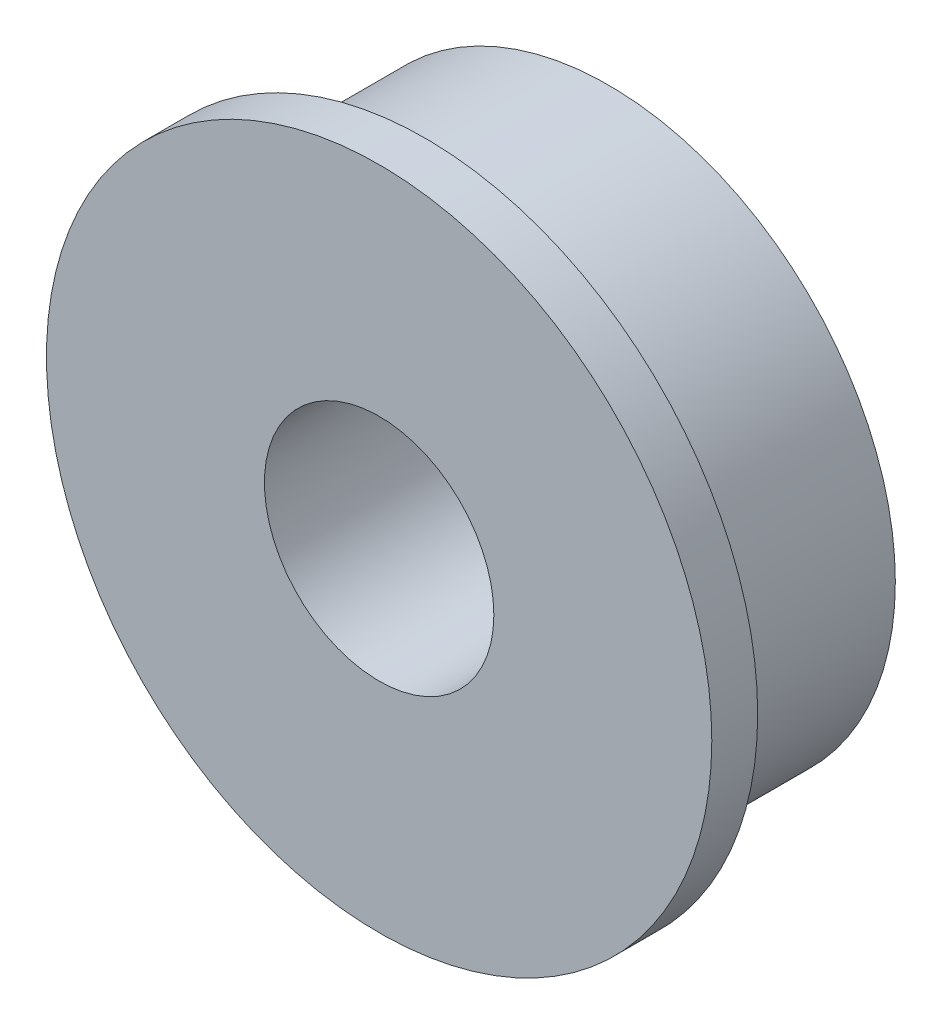
from build123d import *

# Parameters (mm, degrees)
SKETCH_1_R      = 5
SKETCH_1_R_2    = 2
EXTRUDE_1_DEPTH = 4
EXTRUDE_START   = -0.8
SKETCH_2_R      = 5.8
SKETCH_2_R_2    = 2
EXTRUDE_2_DEPTH = 0.8


with BuildPart() as part:
    # 草图1 → 凸台-拉伸1 (new body)
    with BuildSketch(Plane.XY):
        Circle(SKETCH_1_R)
        Circle(SKETCH_1_R_2, mode=Mode.SUBTRACT)
    extrude(amount=EXTRUDE_1_DEPTH)

    # 草图2 → 凸台-拉伸2 (add)
    with BuildSketch(Plane.XY.offset(4).offset(EXTRUDE_START)):
        Circle(SKETCH_2_R)
        Circle(SKETCH_2_R_2, mode=Mode.SUBTRACT)
    extrude(amount=EXTRUDE_2_DEPTH)


solid = part.part
